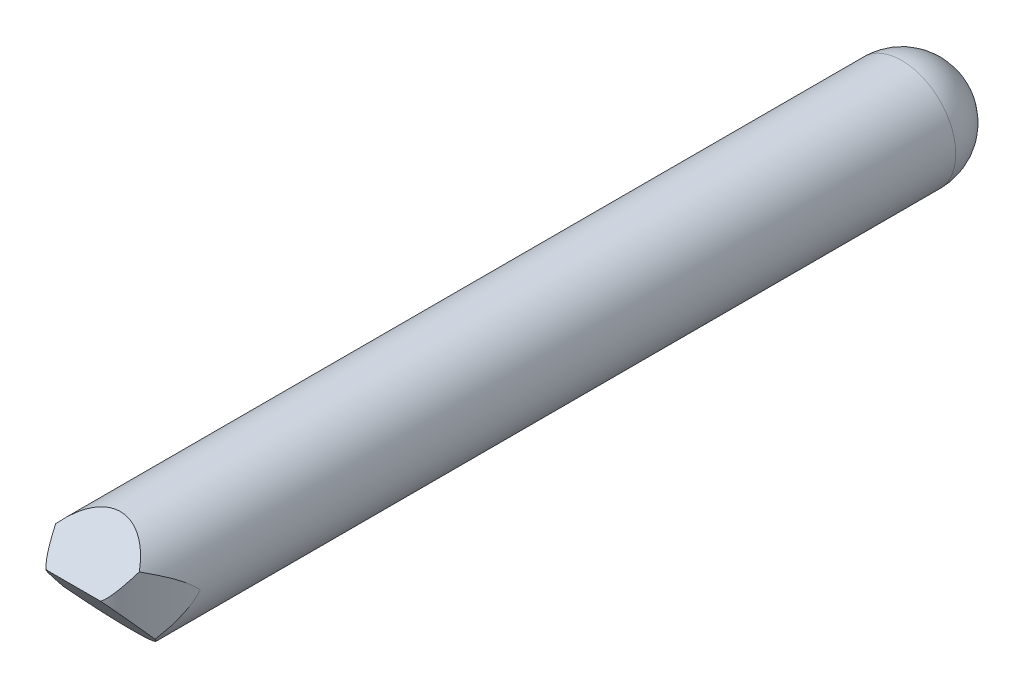
from build123d import *

# Parameters (mm, degrees)
SKETCH1_R           = 152.4
BOSS_EXTRUDE1_DEPTH = 2494.28
CUT_EXTRUDE1_DEPTH  = 203.2
CUT_EXTRUDE2_DEPTH  = 203.2
FILLET1_R           = 152.4


with BuildPart() as part:
    # Sketch1 → Boss-Extrude1 (new body)
    with BuildSketch(Plane.XY):
        with Locations(Location((0, 0, 0), (0, 0, 180))):
            Circle(SKETCH1_R)
    extrude(amount=BOSS_EXTRUDE1_DEPTH)

    # Sketch3 → Cut-Extrude1 (cut, symmetric)
    with BuildSketch(Plane(origin=(0, 0, 0), x_dir=(0, 0, -1), z_dir=(1, 0, 0))):
        Polygon((-2361.35850174, 152.4), (-2494.28, 37.727132557), (-2330.25519021, -152.4), (-2701.978592606, -152.4), (-2701.978592606, 152.4), align=None)
    extrude(amount=CUT_EXTRUDE1_DEPTH, both=True, mode=Mode.SUBTRACT)

    # Sketch4 → Cut-Extrude2 (cut, symmetric)
    with BuildSketch(Plane(origin=(0, 0, 0), x_dir=(1, 0, 0), z_dir=(0, 1, 0))):
        with BuildLine():
            Line((-274.668681528, -2288.432323773), (-274.668681528, -2617.629818427))
            Line((-274.668681528, -2617.629818427), (274.668681528, -2617.629818427))
            Line((274.668681528, -2617.629818427), (274.668681528, -2288.432323773))
            Line((274.668681528, -2288.432323773), (152.4, -2288.432323773))
            add(Edge.make_bspline(
                [(152.4, -2288.432323773), (152.4, -2456.068889623), (76.2, -2494.28)],
                knots=[0, 0, 0, 1, 1, 1], degree=2, weights=[1, 0.380231012, 1]))
            Line((76.2, -2494.28), (-76.2, -2494.28))
            add(Edge.make_bspline(
                [(-152.4, -2288.432323773), (-152.4, -2456.068889623), (-76.2, -2494.28)],
                knots=[0, 0, 0, 1, 1, 1], degree=2, weights=[1, 0.380231012, 1]))
            Line((-152.4, -2288.432323773), (-274.668681528, -2288.432323773))
        make_face()
    extrude(amount=CUT_EXTRUDE2_DEPTH, both=True, mode=Mode.SUBTRACT)

    # Fillet1
    fillet1_edges = [part.edges().sort_by_distance(p)[0] for p in [
        (152.4, 0, 0),
    ]]
    fillet(fillet1_edges, radius=FILLET1_R)


solid = part.part
